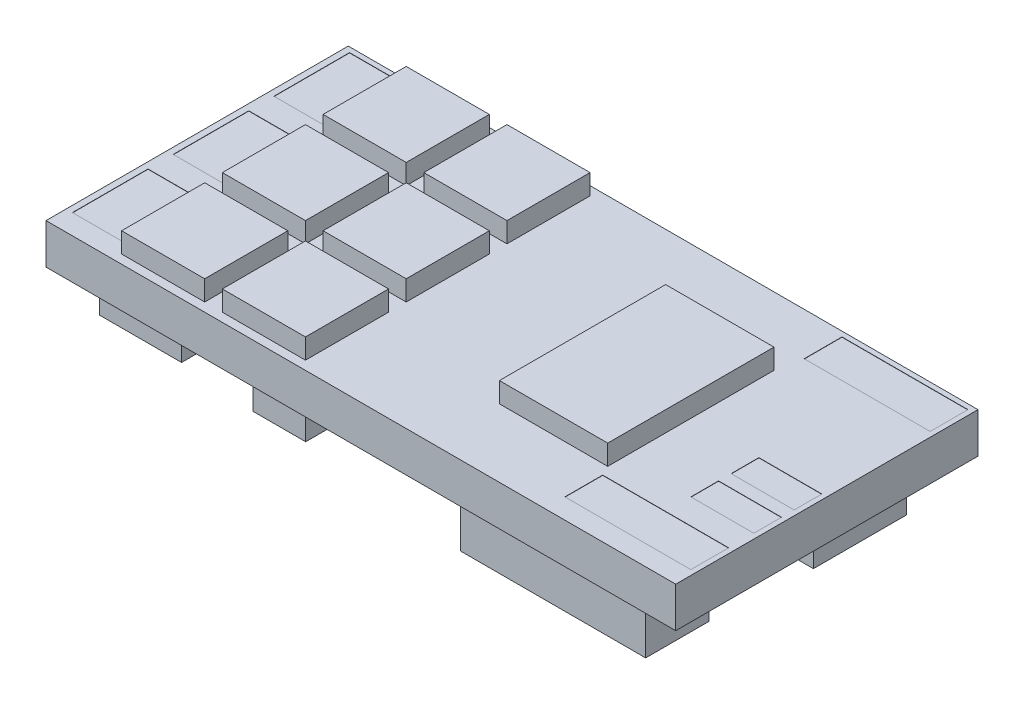
from build123d import *

# Parameters (mm, degrees)
SKETCH1_W           = 25
SKETCH1_H           = 12
BOSS_EXTRUDE1_DEPTH = 1.6
SKETCH2_W           = 3.3
SKETCH2_H           = 3.3
SKETCH2_W_2         = 4.3
SKETCH2_H_2         = 6.6
BOSS_EXTRUDE2_DEPTH = 0.8
SKETCH3_W           = 2
SKETCH3_H           = 3
SKETCH3_W_2         = 5
SKETCH3_H_2         = 1.5
SKETCH3_W_3         = 2.5
SKETCH3_H_3         = 1.1
CUT_EXTRUDE1_DEPTH  = 0.01
SKETCH4_W           = 8.300946921
SKETCH4_H           = 3.688339109
SKETCH4_W_2         = 3.248116331
SKETCH4_H_2         = 9.777349986
SKETCH4_W_3         = 2.1
SKETCH4_H_3         = 2.1
SKETCH4_W_4         = 7.351587475
SKETCH4_H_4         = 2.509074224
BOSS_EXTRUDE3_DEPTH = 1.7


with BuildPart() as part:
    # Sketch1 → Boss-Extrude1 (new body)
    with BuildSketch(Plane(origin=(0, 0, 0), x_dir=(1, 0, 0), z_dir=(0, 1, 0))):
        Rectangle(SKETCH1_W, SKETCH1_H)
    extrude(amount=BOSS_EXTRUDE1_DEPTH)

    # Sketch2 → Boss-Extrude2 (add)
    with BuildSketch(Plane(origin=(0, 1.6, 0), x_dir=(1, 0, 0), z_dir=(0, 1, 0))):
        with Locations((-4.2, 4)):
            Rectangle(SKETCH2_W, SKETCH2_H)
        with Locations((-8.2, -4)):
            Rectangle(SKETCH2_W, SKETCH2_H)
        with Locations((-8.2, 4)):
            Rectangle(SKETCH2_W, SKETCH2_H)
        with Locations((-8.2, 0)):
            Rectangle(SKETCH2_W, SKETCH2_H)
        with Locations((-4.2, 0)):
            Rectangle(SKETCH2_W, SKETCH2_H)
        with Locations((-4.2, -4)):
            Rectangle(SKETCH2_W, SKETCH2_H)
        with Locations((4.95, 0)):
            Rectangle(SKETCH2_W_2, SKETCH2_H_2)
    extrude(amount=BOSS_EXTRUDE2_DEPTH)

    # Sketch3 → Cut-Extrude1 (cut)
    with BuildSketch(Plane(origin=(0, 1.6, 0), x_dir=(1, 0, 0), z_dir=(0, 1, 0))):
        with Locations((-11.25, 4.3)):
            Rectangle(SKETCH3_W, SKETCH3_H)
        with Locations((9.8, -4.45)):
            Rectangle(SKETCH3_W_2, SKETCH3_H_2)
        with Locations((-11.25, 0.3)):
            Rectangle(SKETCH3_W, SKETCH3_H)
        with Locations((-11.25, -3.7)):
            Rectangle(SKETCH3_W, SKETCH3_H)
        with Locations((9.8, 5.05)):
            Rectangle(SKETCH3_W_2, SKETCH3_H_2)
        with Locations((11.05, -2.15)):
            Rectangle(SKETCH3_W_3, SKETCH3_H_3)
        with Locations((11.05, -0.55)):
            Rectangle(SKETCH3_W_3, SKETCH3_H_3)
    extrude(amount=-CUT_EXTRUDE1_DEPTH, mode=Mode.SUBTRACT)

    # Sketch4 → Boss-Extrude3 (add)
    with BuildSketch(Plane.XZ):
        with Locations((7.251224506, -2.408711255)):
            Rectangle(SKETCH4_W, SKETCH4_H)
        with Locations((-9.853821619, 0)):
            Rectangle(SKETCH4_W_2, SKETCH4_H_2)
        with Locations((-4.089790985, 4.1)):
            Rectangle(SKETCH4_W_3, SKETCH4_H_3)
        with Locations((-4.089790985, 0)):
            Rectangle(SKETCH4_W_3, SKETCH4_H_3)
        with Locations((-4.089790985, -4.1)):
            Rectangle(SKETCH4_W_3, SKETCH4_H_3)
        with Locations((7.464495816, 4.579060458)):
            Rectangle(SKETCH4_W_4, SKETCH4_H_4)
    extrude(amount=BOSS_EXTRUDE3_DEPTH)


solid = part.part
